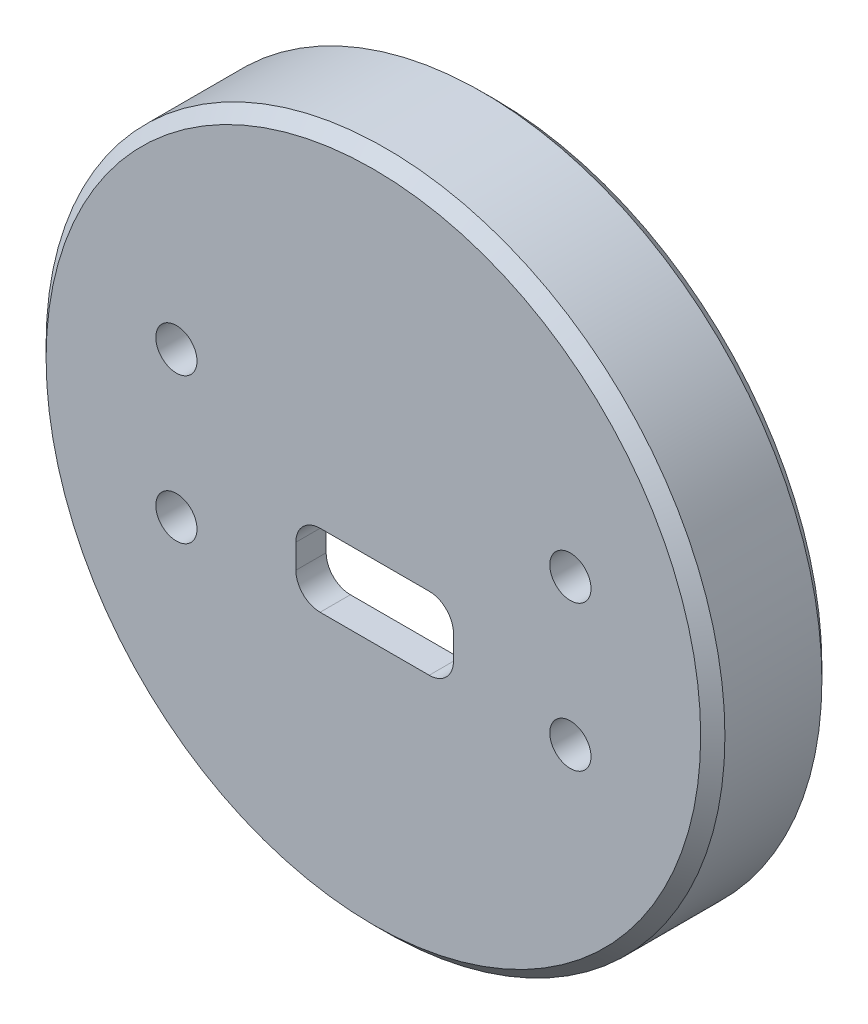
from build123d import *

# Parameters (mm, degrees)
SKETCH_1_R          = 28
EXTRUDE_1_DEPTH     = 10
SKETCH_3_R          = 25
CUT_EXTRUDE_2_DEPTH = 7.5
CUT_EXTRUDE_4_REACH = 42.302
SKETCH_6_W          = 13
SKETCH_6_H          = 6
FILLET_3_R          = 2
HOLE_WIZARD_M31_D   = 3.4
CHAMFER_1_SIZE      = 1


with BuildPart() as part:
    # Эскиз1 → Бобышка-Вытянуть1 (new body)
    with BuildSketch(Plane.XY):
        Circle(SKETCH_1_R)
    extrude(amount=EXTRUDE_1_DEPTH)

    # Эскиз3 → Вырез-Вытянуть2 (cut)
    with BuildSketch(Plane(origin=(0, 0, 0), x_dir=(-1, 0, 0), z_dir=(0, 0, -1))):
        Circle(SKETCH_3_R)
    extrude(amount=-CUT_EXTRUDE_2_DEPTH, mode=Mode.SUBTRACT)

    # Эскиз6 → Вырез-Вытянуть4 (cut, up to next)
    with BuildSketch(Plane(origin=(0, 0, 7.5), x_dir=(-1, 0, 0), z_dir=(0, 0, -1)), mode=Mode.PRIVATE) as cut_extrude_4_sk1:
        with Locations((-0.103380177, -3.86)):
            Rectangle(SKETCH_6_W, SKETCH_6_H)
    cut_extrude_4_tool1 = extrude(cut_extrude_4_sk1.sketch, amount=-CUT_EXTRUDE_4_REACH, mode=Mode.PRIVATE) & part.part
    add(cut_extrude_4_tool1.solids().sort_by_distance((0.10338, -3.86, 7.5))[0], mode=Mode.SUBTRACT)

    # Скругление3
    fillet_3_edges = [part.edges().sort_by_distance(p)[0] for p in [
        (-6.396619823, -0.86, 8.75),
        (-6.396619823, -6.86, 8.75),
        (6.603380177, -6.86, 8.75),
        (6.603380177, -0.86, 8.75),
    ]]
    fillet(fillet_3_edges, radius=FILLET_3_R)

    # Отверстие с зазором M31 (through all)
    with Locations(Plane(origin=(0, 0, 7.5), x_dir=(-1, 0, 0), z_dir=(0, 0, -1))):
        with Locations((16.25, -6), (16.25, 6), (-16.25, 6), (-16.25, -6)):
            Hole(HOLE_WIZARD_M31_D / 2)

    # Фаска1
    chamfer_1_edges = [part.edges().sort_by_distance(p)[0] for p in [
        (-28, 0, 0),
        (-28, 0, 10),
    ]]
    chamfer(chamfer_1_edges, length=CHAMFER_1_SIZE)


solid = part.part
